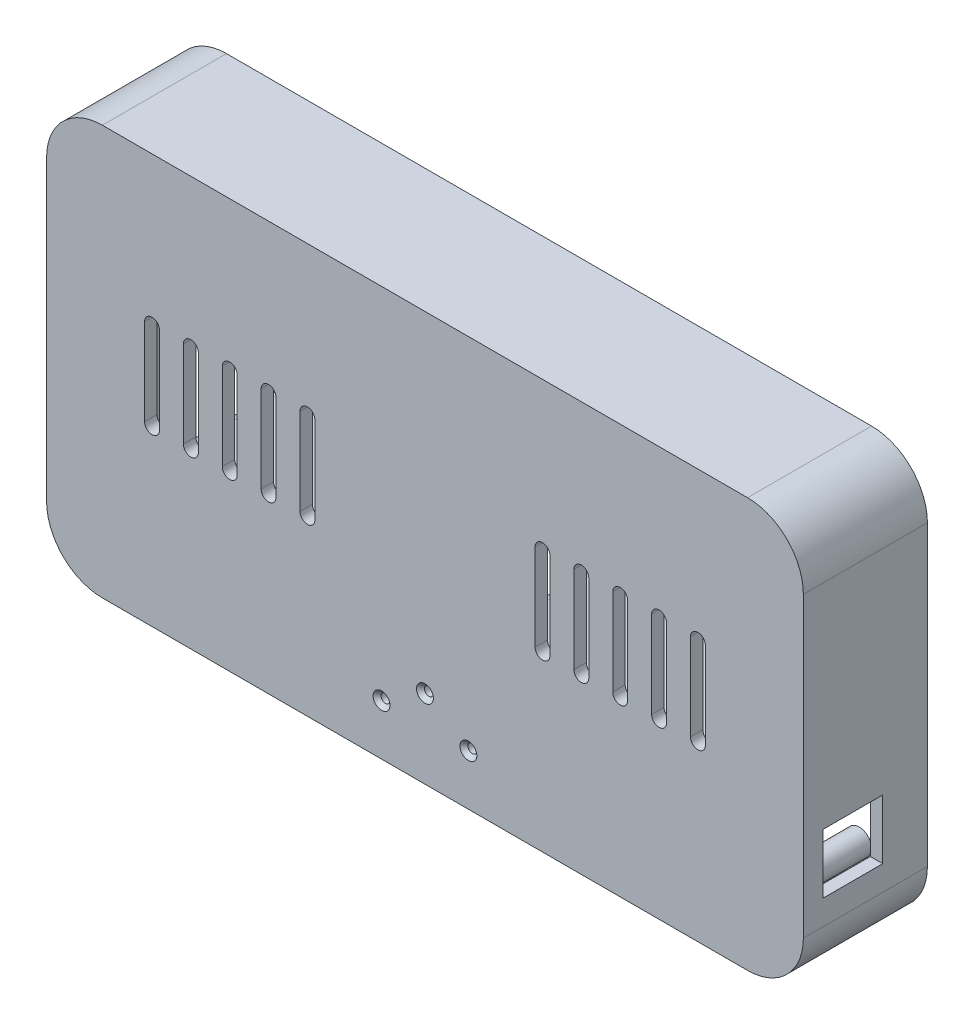
from build123d import *

# Parameters (mm, degrees)
EXTRUDE_1_DEPTH              = 50
SKETCH_1_4_R                 = 5.05
SKETCH_1_4_R_2               = 5.15
CUT_EXTRUDE_1_DEPTH          = 45
CUT_EXTRUDE_2_DEPTH          = 5
SKETCH_1_6_R                 = 5.05
SKETCH_1_6_R_2               = 5.15
CUT_EXTRUDE_3_DEPTH          = 5
SKETCH_1_7_R                 = 2.55
CUT_EXTRUDE_4_DEPTH          = 25
SKETCH_14_R                  = 1.6
SKETCH_14_W                  = 14
SKETCH_14_H                  = 9
USB_DEPTH                    = 5
SKETCH_16_W                  = 24
SKETCH_16_H                  = 24
CUT_EXTRUDE_12_DEPTH         = 5
SKETCH_18_W                  = 24
SKETCH_18_H                  = 24
CUT_EXTRUDE_13_DEPTH         = 5
EXTRUDE_2_DEPTH              = 40
SKETCH_29_4_R                = 2.85
SKETCH_29_4_R_2              = 1.15
EXTRUDE_4_DEPTH              = 5
SKETCH_29_5_R                = 3.4
SKETCH_29_5_R_2              = 1.2
EXTRUDE_5_DEPTH              = 6.5
CUT_EXTRUDE_START            = -2
SKETCH_29_R                  = 1.15
SKETCH_29_R_2                = 1.2
CUT_EXTRUDE_14_DEPTH         = 2
SKETCH_30_R                  = 1.6
CUT_EXTRUDE_21_DEPTH         = 5
HOLE_WIZARD_M3_1_D           = 3.6
HOLE_WIZARD_M3_1_CSINK_D     = 6.8
HOLE_WIZARD_M3_1_CSINK_ANGLE = 90
CUT_EXTRUDE_23_REACH         = 181.13


with BuildPart() as part:
    # 草图1 → 凸台-拉伸1 (new body)
    with BuildSketch(Plane.XY):
        with BuildLine():
            Line((-130, 82.5), (130, 82.5))
            ThreePointArc((130, 82.5), (145.909902577, 75.909902577), (152.5, 60))
            Line((152.5, 60), (152.5, -60))
            ThreePointArc((152.5, -60), (145.909902577, -75.909902577), (130, -82.5))
            Line((130, -82.5), (-130, -82.5))
            ThreePointArc((-130, -82.5), (-145.909902577, -75.909902577), (-152.5, -60))
            Line((-152.5, -60), (-152.5, 60))
            ThreePointArc((-152.5, 60), (-145.909902577, 75.909902577), (-130, 82.5))
        make_face()
    extrude(amount=EXTRUDE_1_DEPTH)

    # 草图1<4> → 切除-拉伸1 (cut)
    with BuildSketch(Plane.XY):
        with BuildLine():
            Line((-130, 77.5), (130, 77.5))
            ThreePointArc((130, 77.5), (142.374368671, 72.374368671), (147.5, 60))
            Line((147.5, 60), (147.5, -60))
            ThreePointArc((147.5, -60), (142.374368671, -72.374368671), (130, -77.5))
            Line((130, -77.5), (-130, -77.5))
            ThreePointArc((-130, -77.5), (-142.374368671, -72.374368671), (-147.5, -60))
            Line((-147.5, -60), (-147.5, 60))
            ThreePointArc((-147.5, 60), (-142.374368671, 72.374368671), (-130, 77.5))
        make_face()
        with Locations(Location((130, 60, 0), (0, 0, 180))):
            Circle(SKETCH_1_4_R, mode=Mode.SUBTRACT)
        with Locations(Location((130, -60, 0), (0, 0, 180))):
            Circle(SKETCH_1_4_R, mode=Mode.SUBTRACT)
        with Locations(Location((-130, 60, 0), (0, 0, 180))):
            Circle(SKETCH_1_4_R_2, mode=Mode.SUBTRACT)
        with Locations(Location((-130, -60, 0), (0, 0, 180))):
            Circle(SKETCH_1_4_R_2, mode=Mode.SUBTRACT)
    extrude(amount=CUT_EXTRUDE_1_DEPTH, mode=Mode.SUBTRACT)

    # 草图1<5> → 切除-拉伸2 (cut)
    with BuildSketch(Plane.XY):
        with BuildLine():
            ThreePointArc((-150.2, 60), (-144.28355698, 74.28355698), (-130, 80.2))
            Line((-130, 80.2), (130, 80.2))
            ThreePointArc((130, 80.2), (144.28355698, 74.28355698), (150.2, 60))
            Line((150.2, 60), (150.2, -60))
            ThreePointArc((150.2, -60), (144.28355698, -74.28355698), (130, -80.2))
            Line((130, -80.2), (-130, -80.2))
            ThreePointArc((-130, -80.2), (-144.28355698, -74.28355698), (-150.2, -60))
            Line((-150.2, -60), (-150.2, 60))
        make_face()
        with BuildLine():
            Line((-147.5, 60), (-147.5, -60))
            ThreePointArc((-147.5, -60), (-142.374368671, -72.374368671), (-130, -77.5))
            Line((-130, -77.5), (130, -77.5))
            ThreePointArc((130, -77.5), (142.374368671, -72.374368671), (147.5, -60))
            Line((147.5, -60), (147.5, 60))
            ThreePointArc((147.5, 60), (142.374368671, 72.374368671), (130, 77.5))
            Line((130, 77.5), (-130, 77.5))
            ThreePointArc((-130, 77.5), (-142.374368671, 72.374368671), (-147.5, 60))
        make_face(mode=Mode.SUBTRACT)
    extrude(amount=CUT_EXTRUDE_2_DEPTH, mode=Mode.SUBTRACT)

    # 草图1<6> → 切除-拉伸3 (cut)
    with BuildSketch(Plane.XY):
        with Locations(Location((130, 60, 0), (0, 0, 180))):
            Circle(SKETCH_1_6_R)
        with Locations(Location((130, -60, 0), (0, 0, 180))):
            Circle(SKETCH_1_6_R)
        with Locations(Location((-130, 60, 0), (0, 0, 180))):
            Circle(SKETCH_1_6_R_2)
        with Locations(Location((-130, -60, 0), (0, 0, 180))):
            Circle(SKETCH_1_6_R_2)
    extrude(amount=CUT_EXTRUDE_3_DEPTH, mode=Mode.SUBTRACT)

    # 草图1<7> → 切除-拉伸4 (cut)
    with BuildSketch(Plane.XY):
        with Locations((-130, -60)):
            Circle(SKETCH_1_7_R)
        with Locations((130, 60)):
            Circle(SKETCH_1_7_R)
        with Locations((130, -60)):
            Circle(SKETCH_1_7_R)
        with Locations((-130, 60)):
            Circle(SKETCH_1_7_R)
    extrude(amount=CUT_EXTRUDE_4_DEPTH, mode=Mode.SUBTRACT)

    # 草图14 → USB口 (cut)
    with BuildSketch(Plane.XZ.offset(82.5)):
        with Locations(Location((-70.9, 38, 0), (0, 0, 270))):
            Circle(SKETCH_14_R)
        with Locations(Location((-89.1, 38, 0), (0, 0, 270))):
            Circle(SKETCH_14_R)
        with Locations((-80, 38)):
            Rectangle(SKETCH_14_W, SKETCH_14_H)
    extrude(amount=-USB_DEPTH, mode=Mode.SUBTRACT)

    # 草图16 → 切除-拉伸12 (cut)
    with BuildSketch(Plane(origin=(152.5, 0, 0), x_dir=(0, 0, -1), z_dir=(1, 0, 0))):
        with Locations((-30, -38)):
            Rectangle(SKETCH_16_W, SKETCH_16_H)
    extrude(amount=-CUT_EXTRUDE_12_DEPTH, mode=Mode.SUBTRACT)

    # 草图18 → 切除-拉伸13 (cut)
    with BuildSketch(Plane.ZY.offset(152.5)):
        with Locations((30, -38)):
            Rectangle(SKETCH_18_W, SKETCH_18_H)
    extrude(amount=-CUT_EXTRUDE_13_DEPTH, mode=Mode.SUBTRACT)

    # 草图19 → 凸台-拉伸2 (add)
    with BuildSketch(Plane(origin=(0, 0, 45), x_dir=(-1, 0, 0), z_dir=(0, 0, -1))):
        with BuildLine():
            Line((-103, 40), (-18, 40))
            ThreePointArc((-18, 40), (-14, 36), (-18, 32))
            Line((-18, 32), (-103, 32))
            ThreePointArc((-103, 32), (-107, 36), (-103, 40))
        make_face()
        with BuildLine():
            Line((103, 40), (18, 40))
            ThreePointArc((18, 40), (14, 36), (18, 32))
            Line((18, 32), (103, 32))
            ThreePointArc((103, 32), (107, 36), (103, 40))
        make_face()
        with BuildLine():
            Line((-103, -20), (-23, -20))
            ThreePointArc((-23, -20), (-19, -24), (-23, -28))
            Line((-23, -28), (-103, -28))
            ThreePointArc((-103, -28), (-107, -24), (-103, -20))
        make_face()
        with BuildLine():
            Line((103, -20), (23, -20))
            ThreePointArc((23, -20), (19, -24), (23, -28))
            Line((23, -28), (103, -28))
            ThreePointArc((103, -28), (107, -24), (103, -20))
        make_face()
    extrude(amount=EXTRUDE_2_DEPTH)

    # 草图29<4> → 凸台-拉伸4 (add)
    # profile 1 of 2: a face of its own
    with BuildSketch(Plane(origin=(0, 0, 45), x_dir=(-1, 0, 0), z_dir=(0, 0, -1))):
        with Locations(Location((-17.5, -31.85, 0), (0, 0, 180))):
            Circle(SKETCH_29_4_R)
        with Locations((-17.5, -31.85)):
            Circle(SKETCH_29_4_R_2, mode=Mode.SUBTRACT)
    # profile 2 of 2: a face of its own
    with BuildSketch(Plane(origin=(0, 0, 45), x_dir=(-1, 0, 0), z_dir=(0, 0, -1))):
        with Locations((17.5, -31.85)):
            Circle(SKETCH_29_4_R)
        with Locations(Location((17.5, -31.85, 0), (0, 0, 180))):
            Circle(SKETCH_29_4_R_2, mode=Mode.SUBTRACT)
    extrude(amount=EXTRUDE_4_DEPTH)

    # 草图29<5> → 凸台-拉伸5 (add)
    # profile 1 of 4: a face of its own
    with BuildSketch(Plane(origin=(0, 0, 45), x_dir=(-1, 0, 0), z_dir=(0, 0, -1))):
        with Locations(Location((-30, 20, 0), (0, 0, 180))):
            Circle(SKETCH_29_5_R)
        with Locations(Location((-30, 20, 0), (0, 0, 180))):
            Circle(SKETCH_29_5_R_2, mode=Mode.SUBTRACT)
    # profile 2 of 4: a face of its own
    with BuildSketch(Plane(origin=(0, 0, 45), x_dir=(-1, 0, 0), z_dir=(0, 0, -1))):
        with Locations(Location((-30, -10, 0), (0, 0, 180))):
            Circle(SKETCH_29_5_R)
        with Locations(Location((-30, -10, 0), (0, 0, 180))):
            Circle(SKETCH_29_5_R_2, mode=Mode.SUBTRACT)
    # profile 3 of 4: a face of its own
    with BuildSketch(Plane(origin=(0, 0, 45), x_dir=(-1, 0, 0), z_dir=(0, 0, -1))):
        with Locations(Location((30, 20, 0), (0, 0, 180))):
            Circle(SKETCH_29_5_R)
        with Locations(Location((30, 20, 0), (0, 0, 180))):
            Circle(SKETCH_29_5_R_2, mode=Mode.SUBTRACT)
    # profile 4 of 4: a face of its own
    with BuildSketch(Plane(origin=(0, 0, 45), x_dir=(-1, 0, 0), z_dir=(0, 0, -1))):
        with Locations(Location((30, -10, 0), (0, 0, 180))):
            Circle(SKETCH_29_5_R)
        with Locations(Location((30, -10, 0), (0, 0, 180))):
            Circle(SKETCH_29_5_R_2, mode=Mode.SUBTRACT)
    extrude(amount=EXTRUDE_5_DEPTH)

    # 草图29 → 切除-拉伸14 (cut)
    with BuildSketch(Plane(origin=(0, 0, 45), x_dir=(-1, 0, 0), z_dir=(0, 0, -1)).offset(CUT_EXTRUDE_START)):
        with Locations((17.5, -31.85)):
            Circle(SKETCH_29_R)
        with Locations((-17.5, -31.85)):
            Circle(SKETCH_29_R)
        with Locations(Location((30, -10, 0), (0, 0, 180))):
            Circle(SKETCH_29_R_2)
        with Locations(Location((-30, -10, 0), (0, 0, 180))):
            Circle(SKETCH_29_R_2)
        with Locations(Location((-30, 20, 0), (0, 0, 180))):
            Circle(SKETCH_29_R_2)
        with Locations(Location((30, 20, 0), (0, 0, 180))):
            Circle(SKETCH_29_R_2)
    extrude(amount=CUT_EXTRUDE_14_DEPTH, mode=Mode.SUBTRACT)

    # 草图30 → 切除-拉伸21 (cut)
    with BuildSketch(Plane(origin=(0, 0, 45), x_dir=(-1, 0, 0), z_dir=(0, 0, -1))):
        with Locations((17.5, -62.0866)):
            Circle(SKETCH_30_R)
        with Locations((0, -50.85)):
            Circle(SKETCH_30_R)
        with Locations((-17.5, -62.0866)):
            Circle(SKETCH_30_R)
    extrude(amount=-CUT_EXTRUDE_21_DEPTH, mode=Mode.SUBTRACT)

    # M3 平头机械螺钉的锥形沉头孔1 (through all)
    with Locations(Plane.XY.offset(50)):
        with Locations((17.5, -62.0866), (0, -50.85), (-17.5, -62.0866)):
            CounterSinkHole(HOLE_WIZARD_M3_1_D / 2, HOLE_WIZARD_M3_1_CSINK_D / 2, counter_sink_angle=HOLE_WIZARD_M3_1_CSINK_ANGLE)

    # 草图38 → 切除-拉伸23 (cut, up to next)
    with BuildSketch(Plane(origin=(0, 0, 45), x_dir=(-1, 0, 0), z_dir=(0, 0, -1)), mode=Mode.PRIVATE) as cut_extrude_23_sk1:
        with BuildLine():
            Line((-107, 22.5), (-107, -12.5))
            ThreePointArc((-107, -12.5), (-110, -15.5), (-113, -12.5))
            Line((-113, -12.5), (-113, 22.5))
            ThreePointArc((-113, 22.5), (-110, 25.5), (-107, 22.5))
        make_face()
    cut_extrude_23_tool1 = extrude(cut_extrude_23_sk1.sketch, amount=-CUT_EXTRUDE_23_REACH, mode=Mode.PRIVATE) & part.part
    # 草图38 → 切除-拉伸23 (cut, up to next)
    with BuildSketch(Plane(origin=(0, 0, 45), x_dir=(-1, 0, 0), z_dir=(0, 0, -1)), mode=Mode.PRIVATE) as cut_extrude_23_sk2:
        with BuildLine():
            Line((-97.343565249, 22.5), (-97.343565249, -12.5))
            ThreePointArc((-97.343565249, -12.5), (-94.343565249, -15.5), (-91.343565249, -12.5))
            Line((-91.343565249, -12.5), (-91.343565249, 22.5))
            ThreePointArc((-91.343565249, 22.5), (-94.343565249, 25.5), (-97.343565249, 22.5))
        make_face()
    cut_extrude_23_tool2 = extrude(cut_extrude_23_sk2.sketch, amount=-CUT_EXTRUDE_23_REACH, mode=Mode.PRIVATE) & part.part
    # 草图38 → 切除-拉伸23 (cut, up to next)
    with BuildSketch(Plane(origin=(0, 0, 45), x_dir=(-1, 0, 0), z_dir=(0, 0, -1)), mode=Mode.PRIVATE) as cut_extrude_23_sk3:
        with BuildLine():
            Line((-81.687130498, 22.5), (-81.687130498, -12.5))
            ThreePointArc((-81.687130498, -12.5), (-78.687130498, -15.5), (-75.687130498, -12.5))
            Line((-75.687130498, -12.5), (-75.687130498, 22.5))
            ThreePointArc((-75.687130498, 22.5), (-78.687130498, 25.5), (-81.687130498, 22.5))
        make_face()
    cut_extrude_23_tool3 = extrude(cut_extrude_23_sk3.sketch, amount=-CUT_EXTRUDE_23_REACH, mode=Mode.PRIVATE) & part.part
    # 草图38 → 切除-拉伸23 (cut, up to next)
    with BuildSketch(Plane(origin=(0, 0, 45), x_dir=(-1, 0, 0), z_dir=(0, 0, -1)), mode=Mode.PRIVATE) as cut_extrude_23_sk4:
        with BuildLine():
            Line((-66.030695747, 22.5), (-66.030695747, -12.5))
            ThreePointArc((-66.030695747, -12.5), (-63.030695747, -15.5), (-60.030695747, -12.5))
            Line((-60.030695747, -12.5), (-60.030695747, 22.5))
            ThreePointArc((-60.030695747, 22.5), (-63.030695747, 25.5), (-66.030695747, 22.5))
        make_face()
    cut_extrude_23_tool4 = extrude(cut_extrude_23_sk4.sketch, amount=-CUT_EXTRUDE_23_REACH, mode=Mode.PRIVATE) & part.part
    # 草图38 → 切除-拉伸23 (cut, up to next)
    with BuildSketch(Plane(origin=(0, 0, 45), x_dir=(-1, 0, 0), z_dir=(0, 0, -1)), mode=Mode.PRIVATE) as cut_extrude_23_sk5:
        with BuildLine():
            Line((-50.374260997, 22.5), (-50.374260997, -12.5))
            ThreePointArc((-50.374260997, -12.5), (-47.374260997, -15.5), (-44.374260997, -12.5))
            Line((-44.374260997, -12.5), (-44.374260997, 22.5))
            ThreePointArc((-44.374260997, 22.5), (-47.374260997, 25.5), (-50.374260997, 22.5))
        make_face()
    cut_extrude_23_tool5 = extrude(cut_extrude_23_sk5.sketch, amount=-CUT_EXTRUDE_23_REACH, mode=Mode.PRIVATE) & part.part
    # 草图38 → 切除-拉伸23 (cut, up to next)
    with BuildSketch(Plane(origin=(0, 0, 45), x_dir=(-1, 0, 0), z_dir=(0, 0, -1)), mode=Mode.PRIVATE) as cut_extrude_23_sk6:
        with BuildLine():
            Line((107, 22.5), (107, -12.5))
            ThreePointArc((107, -12.5), (110, -15.5), (113, -12.5))
            Line((113, -12.5), (113, 22.5))
            ThreePointArc((113, 22.5), (110, 25.5), (107, 22.5))
        make_face()
    cut_extrude_23_tool6 = extrude(cut_extrude_23_sk6.sketch, amount=-CUT_EXTRUDE_23_REACH, mode=Mode.PRIVATE) & part.part
    # 草图38 → 切除-拉伸23 (cut, up to next)
    with BuildSketch(Plane(origin=(0, 0, 45), x_dir=(-1, 0, 0), z_dir=(0, 0, -1)), mode=Mode.PRIVATE) as cut_extrude_23_sk7:
        with BuildLine():
            Line((91.343565249, 22.5), (91.343565249, -12.5))
            ThreePointArc((91.343565249, -12.5), (94.343565249, -15.5), (97.343565249, -12.5))
            Line((97.343565249, -12.5), (97.343565249, 22.5))
            ThreePointArc((97.343565249, 22.5), (94.343565249, 25.5), (91.343565249, 22.5))
        make_face()
    cut_extrude_23_tool7 = extrude(cut_extrude_23_sk7.sketch, amount=-CUT_EXTRUDE_23_REACH, mode=Mode.PRIVATE) & part.part
    # 草图38 → 切除-拉伸23 (cut, up to next)
    with BuildSketch(Plane(origin=(0, 0, 45), x_dir=(-1, 0, 0), z_dir=(0, 0, -1)), mode=Mode.PRIVATE) as cut_extrude_23_sk8:
        with BuildLine():
            Line((75.687130498, 22.5), (75.687130498, -12.5))
            ThreePointArc((75.687130498, -12.5), (78.687130498, -15.5), (81.687130498, -12.5))
            Line((81.687130498, -12.5), (81.687130498, 22.5))
            ThreePointArc((81.687130498, 22.5), (78.687130498, 25.5), (75.687130498, 22.5))
        make_face()
    cut_extrude_23_tool8 = extrude(cut_extrude_23_sk8.sketch, amount=-CUT_EXTRUDE_23_REACH, mode=Mode.PRIVATE) & part.part
    # 草图38 → 切除-拉伸23 (cut, up to next)
    with BuildSketch(Plane(origin=(0, 0, 45), x_dir=(-1, 0, 0), z_dir=(0, 0, -1)), mode=Mode.PRIVATE) as cut_extrude_23_sk9:
        with BuildLine():
            Line((60.030695747, 22.5), (60.030695747, -12.5))
            ThreePointArc((60.030695747, -12.5), (63.030695747, -15.5), (66.030695747, -12.5))
            Line((66.030695747, -12.5), (66.030695747, 22.5))
            ThreePointArc((66.030695747, 22.5), (63.030695747, 25.5), (60.030695747, 22.5))
        make_face()
    cut_extrude_23_tool9 = extrude(cut_extrude_23_sk9.sketch, amount=-CUT_EXTRUDE_23_REACH, mode=Mode.PRIVATE) & part.part
    # 草图38 → 切除-拉伸23 (cut, up to next)
    with BuildSketch(Plane(origin=(0, 0, 45), x_dir=(-1, 0, 0), z_dir=(0, 0, -1)), mode=Mode.PRIVATE) as cut_extrude_23_sk10:
        with BuildLine():
            Line((44.374260997, 22.5), (44.374260997, -12.5))
            ThreePointArc((44.374260997, -12.5), (47.374260997, -15.5), (50.374260997, -12.5))
            Line((50.374260997, -12.5), (50.374260997, 22.5))
            ThreePointArc((50.374260997, 22.5), (47.374260997, 25.5), (44.374260997, 22.5))
        make_face()
    cut_extrude_23_tool10 = extrude(cut_extrude_23_sk10.sketch, amount=-CUT_EXTRUDE_23_REACH, mode=Mode.PRIVATE) & part.part
    add(cut_extrude_23_tool1.solids().sort_by_distance((110, 5, 45))[0], mode=Mode.SUBTRACT)
    add(cut_extrude_23_tool2.solids().sort_by_distance((94.343565, 5, 45))[0], mode=Mode.SUBTRACT)
    add(cut_extrude_23_tool3.solids().sort_by_distance((78.68713, 5, 45))[0], mode=Mode.SUBTRACT)
    add(cut_extrude_23_tool4.solids().sort_by_distance((63.030696, 5, 45))[0], mode=Mode.SUBTRACT)
    add(cut_extrude_23_tool5.solids().sort_by_distance((47.374261, 5, 45))[0], mode=Mode.SUBTRACT)
    add(cut_extrude_23_tool6.solids().sort_by_distance((-110, 5, 45))[0], mode=Mode.SUBTRACT)
    add(cut_extrude_23_tool7.solids().sort_by_distance((-94.343565, 5, 45))[0], mode=Mode.SUBTRACT)
    add(cut_extrude_23_tool8.solids().sort_by_distance((-78.68713, 5, 45))[0], mode=Mode.SUBTRACT)
    add(cut_extrude_23_tool9.solids().sort_by_distance((-63.030696, 5, 45))[0], mode=Mode.SUBTRACT)
    add(cut_extrude_23_tool10.solids().sort_by_distance((-47.374261, 5, 45))[0], mode=Mode.SUBTRACT)


solid = part.part
